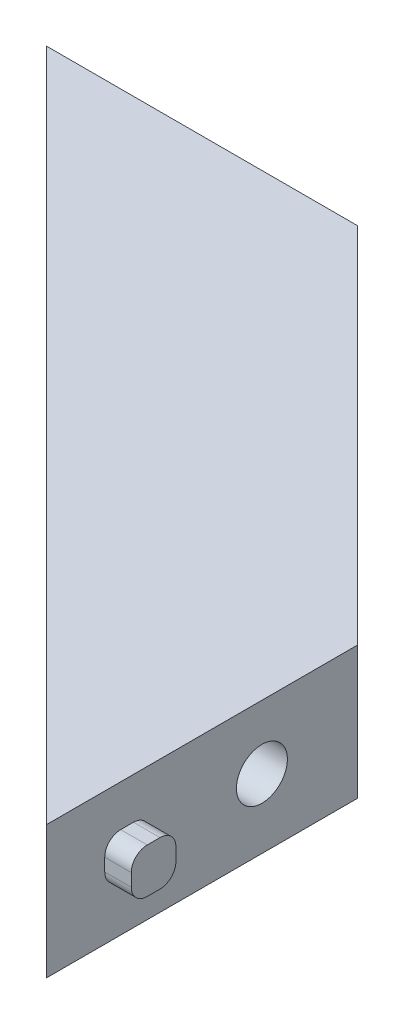
from build123d import *

# Parameters (mm, degrees)
BOSS_EXTRUDE1_DEPTH     = 12.5
BOSS_EXTRUDE2_DEPTH     = 2.5
BOSS_EXTRUDE3_DEPTH     = 2.5
CUT_EXTRUDE1_DEPTH      = 51.023744362
SKETCH5_R               = 2.4
CUT_EXTRUDE2_DEPTH      = 32.5
SKETCH6_R               = 2.4
CUT_EXTRUDE3_DEPTH      = 32.5
CUT_EXTRUDE4_DEPTH      = 12.5
CUT_EXTRUDE4_DEPTH_BACK = 12.5
SKETCH7_R               = 4.25
CUT_EXTRUDE5_DEPTH      = 12.5
CUT_EXTRUDE5_DEPTH_BACK = 12.5
SKETCH8_R               = 4.25


with BuildPart() as part:
    # Sketch1 → Boss-Extrude1 (new body)
    with BuildSketch(Plane(origin=(0, 0, 0), x_dir=(1, 0, 0), z_dir=(0, 1, 0))):
        Polygon((-31.75, 31.75), (31.75, -31.75), (31.75, 31.75), align=None)
    extrude(amount=BOSS_EXTRUDE1_DEPTH)

    # Sketch2 → Boss-Extrude2 (add)
    with BuildSketch(Plane(origin=(31.75, 0, 0), x_dir=(0, 0, -1), z_dir=(1, 0, 0))):
        with BuildLine():
            Line((26.05, 4.4), (27.25, 4.4))
            ThreePointArc((27.25, 4.4), (28.310660172, 4.839339828), (28.75, 5.9))
            Line((28.75, 5.9), (28.75, 7.1))
            ThreePointArc((28.75, 7.1), (28.310660172, 8.160660172), (27.25, 8.6))
            Line((27.25, 8.6), (26.05, 8.6))
            ThreePointArc((26.05, 8.6), (24.989339828, 8.160660172), (24.55, 7.1))
            Line((24.55, 7.1), (24.55, 5.9))
            ThreePointArc((24.55, 5.9), (24.989339828, 4.839339828), (26.05, 4.4))
        make_face()
        with BuildLine():
            Line((11.85, 5.9), (11.85, 7.1))
            ThreePointArc((11.85, 7.1), (12.289339828, 8.160660172), (13.35, 8.6))
            Line((13.35, 8.6), (14.55, 8.6))
            ThreePointArc((14.55, 8.6), (15.610660172, 8.160660172), (16.05, 7.1))
            Line((16.05, 7.1), (16.05, 5.9))
            ThreePointArc((16.05, 5.9), (15.610660172, 4.839339828), (14.55, 4.4))
            Line((14.55, 4.4), (13.35, 4.4))
            ThreePointArc((13.35, 4.4), (12.289339828, 4.839339828), (11.85, 5.9))
        make_face()
        with BuildLine():
            Line((-0.85, 5.9), (-0.85, 7.1))
            ThreePointArc((-0.85, 7.1), (-0.410660172, 8.160660172), (0.65, 8.6))
            Line((0.65, 8.6), (1.85, 8.6))
            ThreePointArc((1.85, 8.6), (2.910660172, 8.160660172), (3.35, 7.1))
            Line((3.35, 7.1), (3.35, 5.9))
            ThreePointArc((3.35, 5.9), (2.910660172, 4.839339828), (1.85, 4.4))
            Line((1.85, 4.4), (0.65, 4.4))
            ThreePointArc((0.65, 4.4), (-0.410660172, 4.839339828), (-0.85, 5.9))
        make_face()
        with BuildLine():
            Line((-13.55, 5.9), (-13.55, 7.1))
            ThreePointArc((-13.55, 7.1), (-13.110660172, 8.160660172), (-12.05, 8.6))
            Line((-12.05, 8.6), (-10.85, 8.6))
            ThreePointArc((-10.85, 8.6), (-9.789339828, 8.160660172), (-9.35, 7.1))
            Line((-9.35, 7.1), (-9.35, 5.9))
            ThreePointArc((-9.35, 5.9), (-9.789339828, 4.839339828), (-10.85, 4.4))
            Line((-10.85, 4.4), (-12.05, 4.4))
            ThreePointArc((-12.05, 4.4), (-13.110660172, 4.839339828), (-13.55, 5.9))
        make_face()
        with BuildLine():
            Line((-26.25, 5.9), (-26.25, 7.1))
            ThreePointArc((-26.25, 7.1), (-25.810660172, 8.160660172), (-24.75, 8.6))
            Line((-24.75, 8.6), (-23.55, 8.6))
            ThreePointArc((-23.55, 8.6), (-22.489339828, 8.160660172), (-22.05, 7.1))
            Line((-22.05, 7.1), (-22.05, 5.9))
            ThreePointArc((-22.05, 5.9), (-22.489339828, 4.839339828), (-23.55, 4.4))
            Line((-23.55, 4.4), (-24.75, 4.4))
            ThreePointArc((-24.75, 4.4), (-25.810660172, 4.839339828), (-26.25, 5.9))
        make_face()
    extrude(amount=BOSS_EXTRUDE2_DEPTH)

    # Sketch3 → Boss-Extrude3 (add)
    with BuildSketch(Plane(origin=(0, 0, -31.75), x_dir=(-1, 0, 0), z_dir=(0, 0, -1))):
        with BuildLine():
            Line((-26.05, 4.4), (-27.25, 4.4))
            ThreePointArc((-27.25, 4.4), (-28.310660172, 4.839339828), (-28.75, 5.9))
            Line((-28.75, 5.9), (-28.75, 7.1))
            ThreePointArc((-28.75, 7.1), (-28.310660172, 8.160660172), (-27.25, 8.6))
            Line((-27.25, 8.6), (-26.05, 8.6))
            ThreePointArc((-26.05, 8.6), (-24.989339828, 8.160660172), (-24.55, 7.1))
            Line((-24.55, 7.1), (-24.55, 5.9))
            ThreePointArc((-24.55, 5.9), (-24.989339828, 4.839339828), (-26.05, 4.4))
        make_face()
        with BuildLine():
            Line((-11.85, 5.9), (-11.85, 7.1))
            ThreePointArc((-11.85, 7.1), (-12.289339828, 8.160660172), (-13.35, 8.6))
            Line((-13.35, 8.6), (-14.55, 8.6))
            ThreePointArc((-14.55, 8.6), (-15.610660172, 8.160660172), (-16.05, 7.1))
            Line((-16.05, 7.1), (-16.05, 5.9))
            ThreePointArc((-16.05, 5.9), (-15.610660172, 4.839339828), (-14.55, 4.4))
            Line((-14.55, 4.4), (-13.35, 4.4))
            ThreePointArc((-13.35, 4.4), (-12.289339828, 4.839339828), (-11.85, 5.9))
        make_face()
        with BuildLine():
            Line((0.85, 5.9), (0.85, 7.1))
            ThreePointArc((0.85, 7.1), (0.410660172, 8.160660172), (-0.65, 8.6))
            Line((-0.65, 8.6), (-1.85, 8.6))
            ThreePointArc((-1.85, 8.6), (-2.910660172, 8.160660172), (-3.35, 7.1))
            Line((-3.35, 7.1), (-3.35, 5.9))
            ThreePointArc((-3.35, 5.9), (-2.910660172, 4.839339828), (-1.85, 4.4))
            Line((-1.85, 4.4), (-0.65, 4.4))
            ThreePointArc((-0.65, 4.4), (0.410660172, 4.839339828), (0.85, 5.9))
        make_face()
        with BuildLine():
            Line((13.55, 5.9), (13.55, 7.1))
            ThreePointArc((13.55, 7.1), (13.110660172, 8.160660172), (12.05, 8.6))
            Line((12.05, 8.6), (10.85, 8.6))
            ThreePointArc((10.85, 8.6), (9.789339828, 8.160660172), (9.35, 7.1))
            Line((9.35, 7.1), (9.35, 5.9))
            ThreePointArc((9.35, 5.9), (9.789339828, 4.839339828), (10.85, 4.4))
            Line((10.85, 4.4), (12.05, 4.4))
            ThreePointArc((12.05, 4.4), (13.110660172, 4.839339828), (13.55, 5.9))
        make_face()
        with BuildLine():
            Line((26.25, 5.9), (26.25, 7.1))
            ThreePointArc((26.25, 7.1), (25.810660172, 8.160660172), (24.75, 8.6))
            Line((24.75, 8.6), (23.55, 8.6))
            ThreePointArc((23.55, 8.6), (22.489339828, 8.160660172), (22.05, 7.1))
            Line((22.05, 7.1), (22.05, 5.9))
            ThreePointArc((22.05, 5.9), (22.489339828, 4.839339828), (23.55, 4.4))
            Line((23.55, 4.4), (24.75, 4.4))
            ThreePointArc((24.75, 4.4), (25.810660172, 4.839339828), (26.25, 5.9))
        make_face()
    extrude(amount=BOSS_EXTRUDE3_DEPTH)

    # Sketch4 → Cut-Extrude1 (cut, through all)
    with BuildSketch(Plane(origin=(0, 12.5, 0), x_dir=(1, 0, 0), z_dir=(0, 1, 0))):
        Polygon((31.75, -2.434304015), (-2.434304015, 31.75), (-2.434304015, 36.268787218), (35.715446441, 36.268787218), (35.715446441, -2.434304015), align=None)
    extrude(amount=-CUT_EXTRUDE1_DEPTH, mode=Mode.SUBTRACT)

    # Sketch5 → Cut-Extrude2 (cut)
    with BuildSketch(Plane(origin=(34.25, 0, 0), x_dir=(0, 0, -1), z_dir=(1, 0, 0))):
        with Locations(Location((-11.45, 6.5, 0), (0, 0, 180))):
            Circle(SKETCH5_R)
    extrude(amount=-CUT_EXTRUDE2_DEPTH, mode=Mode.SUBTRACT)

    # Sketch6 → Cut-Extrude3 (cut)
    with BuildSketch(Plane(origin=(0, 0, -34.25), x_dir=(-1, 0, 0), z_dir=(0, 0, -1))):
        with Locations((11.45, 6.5)):
            Circle(SKETCH6_R)
    extrude(amount=-CUT_EXTRUDE3_DEPTH, mode=Mode.SUBTRACT)

    # Sketch7 → Cut-Extrude4 (cut, two sides: drawn at the far end of the back side and taken through both)
    with BuildSketch(Plane.XY.offset(-9.811165381).offset(-CUT_EXTRUDE4_DEPTH_BACK)):
        with Locations(Location((-11.45, 6.5, 0), (0, 0, 180))):
            Circle(SKETCH7_R)
    extrude(amount=CUT_EXTRUDE4_DEPTH + CUT_EXTRUDE4_DEPTH_BACK, mode=Mode.SUBTRACT)

    # Sketch8 → Cut-Extrude5 (cut, two sides: drawn at the far end of the back side and taken through both)
    with BuildSketch(Plane.ZY.offset(-10.09384537).offset(-CUT_EXTRUDE5_DEPTH_BACK)):
        with Locations((11.45, 6.5)):
            Circle(SKETCH8_R)
    extrude(amount=CUT_EXTRUDE5_DEPTH + CUT_EXTRUDE5_DEPTH_BACK, mode=Mode.SUBTRACT)


solid = part.part
